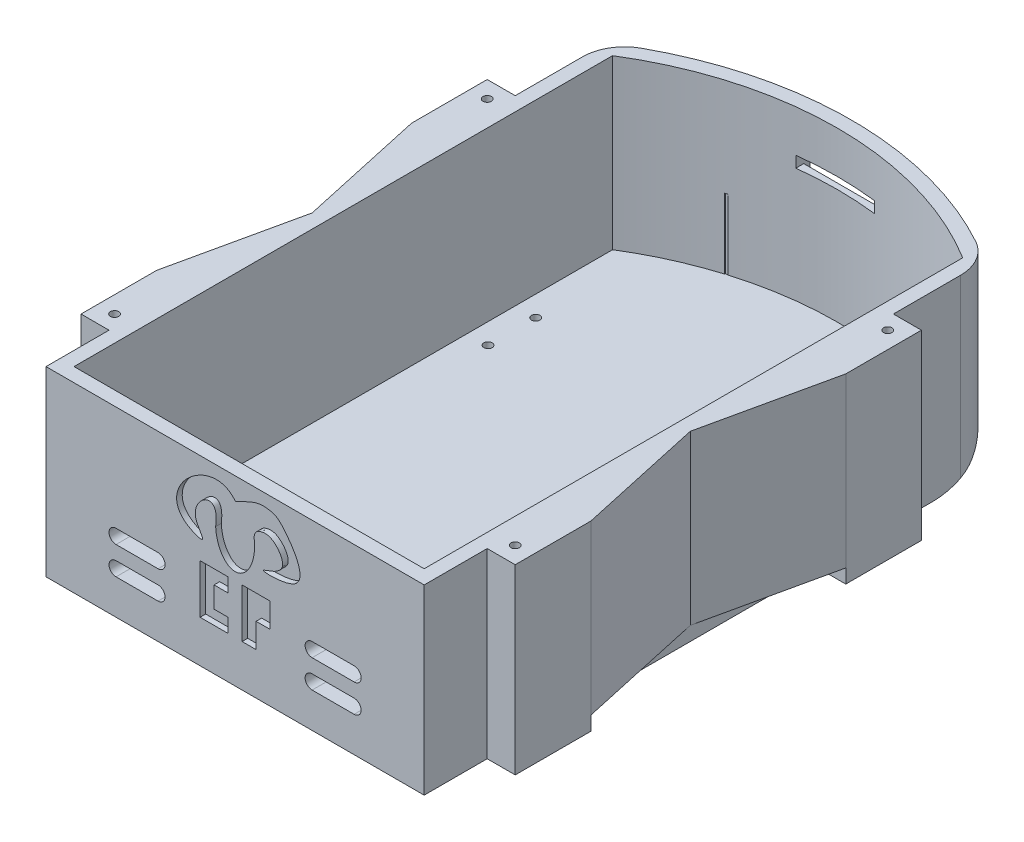
from build123d import *

# Parameters (mm, degrees)
SALIENTE_EXTRUIR1_DEPTH     = 5
CROQUIS2_W                  = 10
CROQUIS2_H                  = 27
SALIENTE_EXTRUIR2_DEPTH     = 5
SALIENTE_EXTRUIR2_2_DEPTH   = 5
SALIENTE_EXTRUIR2_3_DEPTH   = 5
SALIENTE_EXTRUIR2_4_DEPTH   = 5
CROQUIS4_W                  = 10
CROQUIS4_H                  = 27
SALIENTE_EXTRUIR5_DEPTH     = 80
EXTRUIR_L_MINA4_DEPTH       = 80
SALIENTE_EXTRUIR6_DEPTH     = 80
REDONDEO3_R                 = 15
CROQUIS15_W                 = 220
CROQUIS15_H                 = 20
CORTAR_EXTRUIR2_DEPTH       = 100
CROQUIS16_R                 = 1.5
CORTAR_EXTRUIR3_DEPTH       = 10
CROQUIS17_W                 = 5
CROQUIS17_H                 = 91
EXTRUIR_L_MINA5_DEPTH       = 20
CROQUIS18_W                 = 125
CROQUIS18_H                 = 5
EXTRUIR_L_MINA6_DEPTH       = 20
CORTAR_EXTRUIR4_DEPTH       = 174.122788832
CROQUIS20_W                 = 70
CROQUIS20_H                 = 100
CROQUIS20_W_2               = 60
CROQUIS20_H_2               = 90
EXTRUIR_L_MINA7_DEPTH       = 25
CROQUIS21_R                 = 1.5
CORTAR_EXTRUIR5_DEPTH       = 15
CORTAR_EXTRUIR7_REACH       = 182.295
CROQUIS26_W                 = 85
CROQUIS26_H                 = 20
CORTAR_EXTRUIR8_REACH       = 151.436
CROQUIS27_W                 = 60
CROQUIS27_H                 = 20
CROQUIS28_R                 = 1.5
CORTAR_EXTRUIR9_DEPTH       = 5
CORTAR_EXTRUIR10_START      = -122
CROQUIS29_W                 = 28
CROQUIS29_H                 = 28
CORTAR_EXTRUIR10_DEPTH      = 3
CROQUIS33_W                 = 28
CROQUIS33_H                 = 4
CORTAR_EXTRUIR11_DEPTH      = 50
CORTAR_EXTRUIR12_DEPTH      = 199.620240756
CORTAR_EXTRUIR12_DEPTH_BACK = 199.620240756
CROQUIS34_W                 = 91
CROQUIS34_H                 = 20
CORTAR_EXTRUIR13_REACH      = 151.436
CROQUIS35_W                 = 60
CROQUIS35_H                 = 5
CROQUIS36_W                 = 70
CROQUIS36_H                 = 25
CORTAR_EXTRUIR14_DEPTH      = 100
CORTAR_EXTRUIR15_REACH      = 244.139
CORTAR_EXTRUIR16_DEPTH      = 2
CORTAR_EXTRUIR17_DEPTH      = 2


with BuildPart() as part:
    # Croquis1 → Saliente-Extruir1 (new body)
    with BuildSketch(Plane(origin=(0, 0, 0), x_dir=(1, 0, 0), z_dir=(0, 1, 0))):
        with BuildLine():
            Line((-67.5, -95), (67.5, -95))
            Line((67.5, -95), (67.5, 105))
            ThreePointArc((67.5, 105), (0, 125), (-67.5, 105))
            Line((-67.5, 105), (-67.5, -95))
        make_face()
    extrude(amount=SALIENTE_EXTRUIR1_DEPTH)



with BuildPart() as body_2:
    # Croquis2 → Saliente-Extruir2 (new body)
    with BuildSketch(Plane(origin=(0, 5, 0), x_dir=(1, 0, 0), z_dir=(0, 1, 0))):
        with Locations((-72.5, 59)):
            Rectangle(CROQUIS2_W, CROQUIS2_H)
    extrude(amount=-SALIENTE_EXTRUIR2_DEPTH)


with BuildPart() as body_3:
    # Croquis2 → Saliente-Extruir2 2 (new body)
    with BuildSketch(Plane(origin=(0, 5, 0), x_dir=(1, 0, 0), z_dir=(0, 1, 0))):
        with Locations((-72.5, -59)):
            Rectangle(CROQUIS2_W, CROQUIS2_H)
    extrude(amount=-SALIENTE_EXTRUIR2_2_DEPTH)


with BuildPart() as body_4:
    # Croquis2 → Saliente-Extruir2 3 (new body)
    with BuildSketch(Plane(origin=(0, 5, 0), x_dir=(1, 0, 0), z_dir=(0, 1, 0))):
        with Locations((72.5, -59)):
            Rectangle(CROQUIS2_W, CROQUIS2_H)
    extrude(amount=-SALIENTE_EXTRUIR2_3_DEPTH)


with BuildPart() as body_5:
    # Croquis2 → Saliente-Extruir2 4 (new body)
    with BuildSketch(Plane(origin=(0, 5, 0), x_dir=(1, 0, 0), z_dir=(0, 1, 0))):
        with Locations((72.5, 59)):
            Rectangle(CROQUIS2_W, CROQUIS2_H)
    extrude(amount=-SALIENTE_EXTRUIR2_4_DEPTH)


with BuildPart() as part_1:
    add(part.part)

    add(body_2.part)  # Saliente-Extruir5 merges body 2

    add(body_3.part)  # Saliente-Extruir5 merges body 3

    add(body_4.part)  # Saliente-Extruir5 merges body 4

    add(body_5.part)  # Saliente-Extruir5 merges body 5
    # Croquis4 → Saliente-Extruir5 (add)
    with BuildSketch(Plane(origin=(0, 5, 0), x_dir=(1, 0, 0), z_dir=(0, 1, 0))):
        with Locations((72.5, -59)):
            Rectangle(CROQUIS4_W, CROQUIS4_H)
        with Locations((-72.5, 59)):
            Rectangle(CROQUIS4_W, CROQUIS4_H)
        with Locations((72.5, 59)):
            Rectangle(CROQUIS4_W, CROQUIS4_H)
        with Locations((-72.5, -59)):
            Rectangle(CROQUIS4_W, CROQUIS4_H)
    extrude(amount=SALIENTE_EXTRUIR5_DEPTH)

    # Croquis12 → Extruir-Lámina4 (add)
    with BuildSketch(Plane(origin=(0, 5, 0), x_dir=(1, 0, 0), z_dir=(0, 1, 0))):
        with BuildLine():
            Line((-67.5, 105), (-67.5, 72.5))
            Line((-67.5, 72.5), (-67.5, 45.5))
            Line((-67.5, 45.5), (-67.5, -45.5))
            Line((-67.5, -45.5), (-67.5, -72.5))
            Line((-67.5, -72.5), (-67.5, -95))
            Line((-67.5, -95), (67.5, -95))
            Line((67.5, -95), (67.5, -72.5))
            Line((67.5, -72.5), (67.5, -45.5))
            Line((67.5, -45.5), (67.5, 45.5))
            Line((67.5, 45.5), (67.5, 72.5))
            Line((67.5, 72.5), (67.5, 105))
            ThreePointArc((67.5, 105), (0, 125), (-67.5, 105))
        make_face()
        with BuildLine():
            Line((-62.5, 102.24930491), (-62.5, 72.5))
            Line((-62.5, 72.5), (-62.5, 45.5))
            Line((-62.5, 45.5), (-62.5, -45.5))
            Line((-62.5, -45.5), (-62.5, -72.5))
            Line((-62.5, -72.5), (-62.5, -90))
            Line((-62.5, -90), (62.5, -90))
            Line((62.5, -90), (62.5, -72.5))
            Line((62.5, -72.5), (62.5, -45.5))
            Line((62.5, -45.5), (62.5, 45.5))
            Line((62.5, 45.5), (62.5, 72.5))
            Line((62.5, 72.5), (62.5, 102.24930491))
            ThreePointArc((62.5, 102.24930491), (0, 120), (-62.5, 102.24930491))
        make_face(mode=Mode.SUBTRACT)
    extrude(amount=EXTRUIR_L_MINA4_DEPTH)

    # Croquis14 → Saliente-Extruir6 (add)
    with BuildSketch(Plane(origin=(0, 85, 0), x_dir=(1, 0, 0), z_dir=(0, 1, 0))):
        Polygon((67.5, 45.5), (67.5, 0), (77.5, 45.5), align=None)
        Polygon((67.5, 0), (67.5, -45.5), (77.5, -45.5), align=None)
        Polygon((-67.5, -45.5), (-67.5, 0), (-77.5, -45.5), align=None)
        Polygon((-67.5, 0), (-67.5, 45.5), (-77.5, 45.5), align=None)
    extrude(amount=-SALIENTE_EXTRUIR6_DEPTH)

    # Redondeo3
    redondeo3_edges = [part_1.edges().sort_by_distance(p)[0] for p in [
        (0, 0, -125),
        (67.5, 42.5, -105),
        (-67.5, 42.5, -105),
    ]]
    fillet(redondeo3_edges, radius=REDONDEO3_R)

    # Croquis15 → Cortar-Extruir2 (cut, symmetric)
    with BuildSketch(Plane(origin=(0, 0, 0), x_dir=(0, 0, -1), z_dir=(1, 0, 0))):
        with Locations((15, 75)):
            Rectangle(CROQUIS15_W, CROQUIS15_H)
    extrude(amount=CORTAR_EXTRUIR2_DEPTH, both=True, mode=Mode.SUBTRACT)

    # Croquis16 → Cortar-Extruir3 (cut, symmetric)
    with BuildSketch(Plane(origin=(0, 65, 0), x_dir=(1, 0, 0), z_dir=(0, 1, 0))):
        with Locations(Location((71.5, -66.5, 0), (0, 0, 270))):
            Circle(CROQUIS16_R)
        with Locations(Location((71.5, 66.5, 0), (0, 0, 90))):
            Circle(CROQUIS16_R)
        with Locations(Location((-71.5, -66.5, 0), (0, 0, 90))):
            Circle(CROQUIS16_R)
        with Locations(Location((-71.5, 66.5, 0), (0, 0, 270))):
            Circle(CROQUIS16_R)
    extrude(amount=CORTAR_EXTRUIR3_DEPTH, both=True, mode=Mode.SUBTRACT)

    # Croquis17 → Extruir-Lámina5 (add)
    with BuildSketch(Plane.XZ):
        with Locations((65, 0)):
            Rectangle(CROQUIS17_W, CROQUIS17_H)
        with Locations((-65, 0)):
            Rectangle(CROQUIS17_W, CROQUIS17_H)
    extrude(amount=EXTRUIR_L_MINA5_DEPTH)

    # Croquis18 → Extruir-Lámina6 (add)
    with BuildSketch(Plane.XZ):
        with Locations((0, 43)):
            Rectangle(CROQUIS18_W, CROQUIS18_H)
        with Locations((0, -43)):
            Rectangle(CROQUIS18_W, CROQUIS18_H)
    extrude(amount=EXTRUIR_L_MINA6_DEPTH)

    # Croquis19 → Cortar-Extruir4 (cut, through all)
    with BuildSketch(Plane(origin=(0, 0, -45.5), x_dir=(-1, 0, 0), z_dir=(0, 0, -1))):
        with BuildLine():
            Line((-45, -5), (45, -5))
            ThreePointArc((45, -5), (50, -10), (45, -15))
            Line((45, -15), (-45, -15))
            ThreePointArc((-45, -15), (-50, -10), (-45, -5))
        make_face()
    extrude(amount=-CORTAR_EXTRUIR4_DEPTH, mode=Mode.SUBTRACT)

    # Croquis20 → Extruir-Lámina7 (add)
    with BuildSketch(Plane(origin=(0, 5, 0), x_dir=(1, 0, 0), z_dir=(0, 1, 0))):
        with Locations((0, 65)):
            Rectangle(CROQUIS20_W, CROQUIS20_H)
        with Locations((0, 65)):
            Rectangle(CROQUIS20_W_2, CROQUIS20_H_2, mode=Mode.SUBTRACT)
    extrude(amount=EXTRUIR_L_MINA7_DEPTH)

    # Croquis21 → Cortar-Extruir5 (cut)
    with BuildSketch(Plane(origin=(0, 30, 0), x_dir=(1, 0, 0), z_dir=(0, 1, 0))):
        with Locations(Location((-32.5, 21, 0), (0, 0, 270))):
            Circle(CROQUIS21_R)
        with Locations(Location((32.5, 21, 0), (0, 0, 90))):
            Circle(CROQUIS21_R)
        with Locations(Location((32.5, 109, 0), (0, 0, 270))):
            Circle(CROQUIS21_R)
        with Locations(Location((-32.5, 109, 0), (0, 0, 90))):
            Circle(CROQUIS21_R)
    extrude(amount=-CORTAR_EXTRUIR5_DEPTH, mode=Mode.SUBTRACT)

    # Croquis26 → Cortar-Extruir7 (cut, up to next)
    with BuildSketch(Plane.ZY.offset(35), mode=Mode.PRIVATE) as cortar_extruir7_sk1:
        with Locations((-62.5, 15)):
            Rectangle(CROQUIS26_W, CROQUIS26_H)
    cortar_extruir7_tool1 = extrude(cortar_extruir7_sk1.sketch, amount=-CORTAR_EXTRUIR7_REACH, mode=Mode.PRIVATE) & part_1.part
    add(cortar_extruir7_tool1.solids().sort_by_distance((-35, 15, -62.5))[0], mode=Mode.SUBTRACT)

    # Croquis27 → Cortar-Extruir8 (cut, up to next)
    with BuildSketch(Plane.XY.offset(-15), mode=Mode.PRIVATE) as cortar_extruir8_sk1:
        with Locations((0, 15)):
            Rectangle(CROQUIS27_W, CROQUIS27_H)
    cortar_extruir8_tool1 = extrude(cortar_extruir8_sk1.sketch, amount=-CORTAR_EXTRUIR8_REACH, mode=Mode.PRIVATE) & part_1.part
    add(cortar_extruir8_tool1.solids().sort_by_distance((0, 15, -15))[0], mode=Mode.SUBTRACT)

    # Croquis28 → Cortar-Extruir9 (cut)
    with BuildSketch(Plane.XZ):
        with Locations(Location((69.8, 50.5, 0), (0, 0, 270))):
            Circle(CROQUIS28_R)
        with Locations(Location((69.8, 67.5, 0), (0, 0, 90))):
            Circle(CROQUIS28_R)
        with Locations(Location((55.2, 50.5, 0), (0, 0, 90))):
            Circle(CROQUIS28_R)
        with Locations(Location((55.2, 67.5, 0), (0, 0, 270))):
            Circle(CROQUIS28_R)
        with Locations(Location((-55.2, 67.5, 0), (0, 0, 90))):
            Circle(CROQUIS28_R)
        with Locations(Location((-69.8, 67.5, 0), (0, 0, 270))):
            Circle(CROQUIS28_R)
        with Locations(Location((-69.8, 50.5, 0), (0, 0, 90))):
            Circle(CROQUIS28_R)
        with Locations(Location((-55.2, 50.5, 0), (0, 0, 270))):
            Circle(CROQUIS28_R)
        with Locations(Location((55.2, -67.5, 0), (0, 0, 90))):
            Circle(CROQUIS28_R)
        with Locations(Location((69.8, -67.5, 0), (0, 0, 270))):
            Circle(CROQUIS28_R)
        with Locations(Location((69.8, -50.5, 0), (0, 0, 90))):
            Circle(CROQUIS28_R)
        with Locations(Location((55.2, -50.5, 0), (0, 0, 270))):
            Circle(CROQUIS28_R)
        with Locations(Location((-55.2, -67.5, 0), (0, 0, 270))):
            Circle(CROQUIS28_R)
        with Locations(Location((-69.8, -67.5, 0), (0, 0, 90))):
            Circle(CROQUIS28_R)
        with Locations(Location((-69.8, -50.5, 0), (0, 0, 270))):
            Circle(CROQUIS28_R)
        with Locations(Location((-55.2, -50.5, 0), (0, 0, 90))):
            Circle(CROQUIS28_R)
    extrude(amount=-CORTAR_EXTRUIR9_DEPTH, mode=Mode.SUBTRACT)

    # Croquis29 → Cortar-Extruir10 (cut)
    with BuildSketch(Plane.XY.offset(CORTAR_EXTRUIR10_START)):
        with Locations((0, 36)):
            Rectangle(CROQUIS29_W, CROQUIS29_H)
    extrude(amount=-CORTAR_EXTRUIR10_DEPTH, mode=Mode.SUBTRACT)

    # Croquis33 → Cortar-Extruir11 (cut)
    with BuildSketch(Plane(origin=(0, 0, -122), x_dir=(-1, 0, 0), z_dir=(0, 0, -1))):
        with Locations((0, 48)):
            Rectangle(CROQUIS33_W, CROQUIS33_H)
    extrude(amount=-CORTAR_EXTRUIR11_DEPTH, mode=Mode.SUBTRACT)

    # Croquis34 → Cortar-Extruir12 (cut, two sides: drawn at the far end of the back side and taken through both)
    with BuildSketch(Plane.ZY.offset(-62.5).offset(-CORTAR_EXTRUIR12_DEPTH_BACK)):
        with Locations((0, -10)):
            Rectangle(CROQUIS34_W, CROQUIS34_H)
    extrude(amount=CORTAR_EXTRUIR12_DEPTH + CORTAR_EXTRUIR12_DEPTH_BACK, mode=Mode.SUBTRACT)

    # Croquis35 → Cortar-Extruir13 (cut, up to next)
    with BuildSketch(Plane.XY.offset(-15), mode=Mode.PRIVATE) as cortar_extruir13_sk1:
        with Locations((0, 27.5)):
            Rectangle(CROQUIS35_W, CROQUIS35_H)
    cortar_extruir13_tool1 = extrude(cortar_extruir13_sk1.sketch, amount=-CORTAR_EXTRUIR13_REACH, mode=Mode.PRIVATE) & part_1.part
    add(cortar_extruir13_tool1.solids().sort_by_distance((0, 27.5, -15))[0], mode=Mode.SUBTRACT)

    # Croquis36 → Cortar-Extruir14 (cut)
    with BuildSketch(Plane.XY.offset(-15)):
        with Locations((0, 17.5)):
            Rectangle(CROQUIS36_W, CROQUIS36_H)
    extrude(amount=-CORTAR_EXTRUIR14_DEPTH, mode=Mode.SUBTRACT)

    # Croquis37 → Cortar-Extruir15 (cut, up to next)
    with BuildSketch(Plane.XY.offset(95), mode=Mode.PRIVATE) as cortar_extruir15_sk1:
        with BuildLine():
            Line((-42.5, 17.5), (-27.5, 17.5))
            ThreePointArc((-27.5, 17.5), (-25, 15), (-27.5, 12.5))
            Line((-27.5, 12.5), (-42.5, 12.5))
            ThreePointArc((-42.5, 12.5), (-45, 15), (-42.5, 17.5))
        make_face()
    cortar_extruir15_tool1 = extrude(cortar_extruir15_sk1.sketch, amount=-CORTAR_EXTRUIR15_REACH, mode=Mode.PRIVATE) & part_1.part
    # Croquis37 → Cortar-Extruir15 (cut, up to next)
    with BuildSketch(Plane.XY.offset(95), mode=Mode.PRIVATE) as cortar_extruir15_sk2:
        with BuildLine():
            Line((-42.5, 22.5), (-27.5, 22.5))
            ThreePointArc((-27.5, 22.5), (-25, 25), (-27.5, 27.5))
            Line((-27.5, 27.5), (-42.5, 27.5))
            ThreePointArc((-42.5, 27.5), (-45, 25), (-42.5, 22.5))
        make_face()
    cortar_extruir15_tool2 = extrude(cortar_extruir15_sk2.sketch, amount=-CORTAR_EXTRUIR15_REACH, mode=Mode.PRIVATE) & part_1.part
    # Croquis37 → Cortar-Extruir15 (cut, up to next)
    with BuildSketch(Plane.XY.offset(95), mode=Mode.PRIVATE) as cortar_extruir15_sk3:
        with BuildLine():
            Line((42.5, 17.5), (27.5, 17.5))
            ThreePointArc((27.5, 17.5), (25, 15), (27.5, 12.5))
            Line((27.5, 12.5), (42.5, 12.5))
            ThreePointArc((42.5, 12.5), (45, 15), (42.5, 17.5))
        make_face()
    cortar_extruir15_tool3 = extrude(cortar_extruir15_sk3.sketch, amount=-CORTAR_EXTRUIR15_REACH, mode=Mode.PRIVATE) & part_1.part
    # Croquis37 → Cortar-Extruir15 (cut, up to next)
    with BuildSketch(Plane.XY.offset(95), mode=Mode.PRIVATE) as cortar_extruir15_sk4:
        with BuildLine():
            Line((42.5, 22.5), (27.5, 22.5))
            ThreePointArc((27.5, 22.5), (25, 25), (27.5, 27.5))
            Line((27.5, 27.5), (42.5, 27.5))
            ThreePointArc((42.5, 27.5), (45, 25), (42.5, 22.5))
        make_face()
    cortar_extruir15_tool4 = extrude(cortar_extruir15_sk4.sketch, amount=-CORTAR_EXTRUIR15_REACH, mode=Mode.PRIVATE) & part_1.part
    add(cortar_extruir15_tool1.solids().sort_by_distance((-35, 15, 95))[0], mode=Mode.SUBTRACT)
    add(cortar_extruir15_tool2.solids().sort_by_distance((-35, 25, 95))[0], mode=Mode.SUBTRACT)
    add(cortar_extruir15_tool3.solids().sort_by_distance((35, 15, 95))[0], mode=Mode.SUBTRACT)
    add(cortar_extruir15_tool4.solids().sort_by_distance((35, 25, 95))[0], mode=Mode.SUBTRACT)

    # Croquis23 → Cortar-Extruir16 (cut)
    with BuildSketch(Plane.XY.offset(95)):
        with BuildLine():
            add(Edge.make_bspline(
                [(-6.941319119, 45.792736836), (-6.36662349, 34.537002147), (0.536039105, 35.406219345), (7.438701701, 36.275436542), (6.947828506, 47.541726564)],
                knots=[4.795494793, 4.795494793, 4.795494793, 6.360219335, 6.360219335, 7.924943878, 7.924943878, 7.924943878], degree=2, weights=[1, 0.709250219, 1, 0.709250219, 1]))
            add(Edge.make_bspline(
                [(6.947828506, 47.541726564), (6.710531016, 49.552293969), (6.367921085, 52.09089255), (13.414263493, 52.911827323), (21.258767726, 43.073212917), (2.562856997, 40.26492205), (27.319979568, 39.869500151), (21.461126335, 52.684908181), (15.281415628, 59.763496215), (8.942180612, 61.438619348), (6.511042979, 60.326661558), (0.1588757, 57.075570562)],
                knots=[0.012478218, 0.012478218, 0.012478218, 0.012478218, 0.104727482, 0.122183384, 0.187037245, 0.309753771, 0.453793407, 0.616774377, 0.686520291, 0.724842853, 1, 1, 1, 1], degree=3))
            add(Edge.make_bspline(
                [(-6.941319119, 45.792736836), (-5.190661894, 57.956400848), (-19.404965018, 48.975836575), (-8.665423996, 37.446473376), (-32.7836685, 46.685414588), (-7.823554221, 67.767324869), (0.1588757, 57.075570562)],
                knots=[0, 0, 0, 0, 0.267888426, 0.369212812, 0.489808383, 1, 1, 1, 1], degree=3))
        make_face()
    extrude(amount=-CORTAR_EXTRUIR16_DEPTH, mode=Mode.SUBTRACT)

    # Croquis25 → Cortar-Extruir17 (cut)
    with BuildSketch(Plane.XY.offset(95)):
        Polygon((-2.5, 15), (-12.5, 15), (-12.5, 32.5), (-2.5, 32.5), (-2.5, 27.5), (-7.5, 27.5), (-7.5, 20), (-2.5, 20), align=None)
        Polygon((2.5, 15), (2.5, 32.5), (12.5, 32.5), (12.5, 23.75), (7.5, 23.75), (7.5, 15), align=None)
    extrude(amount=-CORTAR_EXTRUIR17_DEPTH, mode=Mode.SUBTRACT)


solid = part_1.part
